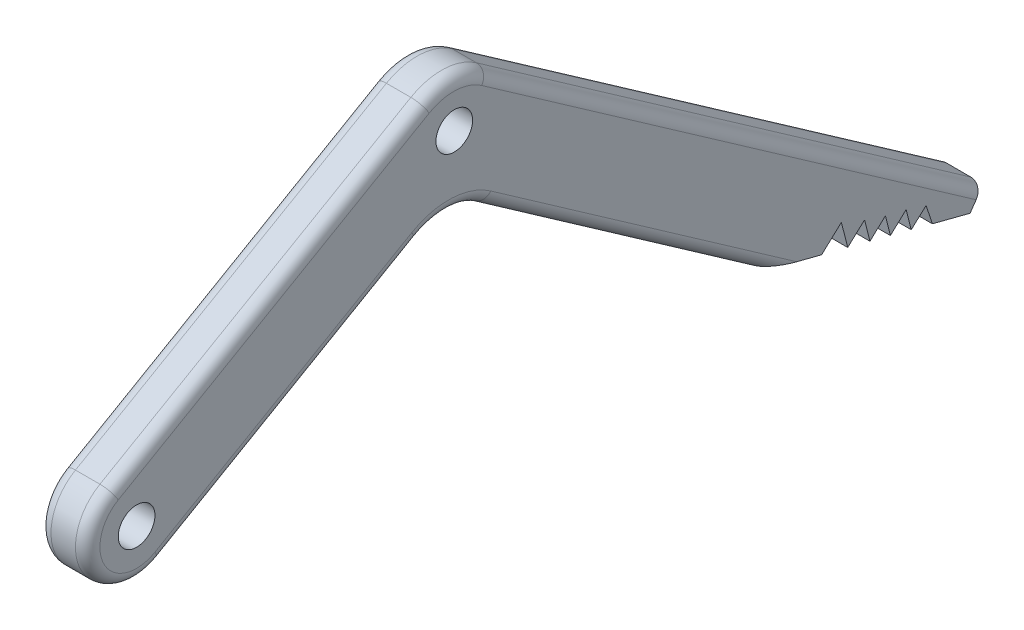
from build123d import *

# Parameters (mm, degrees)
SKETCH1_R           = 1.5
BOSS_EXTRUDE1_DEPTH = 4
FILLET1_R           = 1


with BuildPart() as part:
    # Sketch1 → Boss-Extrude1 (new body)
    with BuildSketch(Plane(origin=(0, 0, 0), x_dir=(0, 0, -1), z_dir=(1, 0, 0))):
        with BuildLine():
            Line((2, -3.464101615), (23.015290845, 8.669082211))
            ThreePointArc((23.015290845, 8.669082211), (25.733387782, 9.3341963), (28.383173027, 8.434715414))
            Line((28.383173027, 8.434715414), (51.232670073, -7.564674663))
            Line((51.232670073, -7.564674663), (56.023067, -8.799461594))
            Line((56.023067, -8.799461594), (57.638075063, -7.307602004))
            Line((57.638075063, -7.307602004), (58.156839412, -9.349469104))
            Line((58.156839412, -9.349469104), (59.53422498, -8.07711269))
            Line((59.53422498, -8.07711269), (59.976661488, -9.818551844))
            Line((59.976661488, -9.818551844), (61.239859239, -8.642065932))
            Line((61.239859239, -8.642065932), (61.648229646, -10.249420215))
            Line((61.648229646, -10.249420215), (62.934954569, -9.051022147))
            Line((62.934954569, -9.051022147), (63.350930911, -10.688313547))
            Line((63.350930911, -10.688313547), (64.567456775, -9.58151124))
            Line((64.567456775, -9.58151124), (65.081008751, -11.134263546))
            Line((65.081008751, -11.134263546), (68.163696398, -11.928866264))
            Line((68.163696398, -11.928866264), (69.232670073, -10.40221364))
            Line((69.232670073, -10.40221364), (28.796925265, 17.911199687))
            ThreePointArc((28.796925265, 17.911199687), (26.147140021, 18.810680574), (23.429043084, 18.145566485))
            Line((23.429043084, 18.145566485), (-2, 3.464101615))
            ThreePointArc((-2, 3.464101615), (-3.464101615, -2), (2, -3.464101615))
        make_face()
        Circle(SKETCH1_R, mode=Mode.SUBTRACT)
        with Locations((25.980762114, 15)):
            Circle(SKETCH1_R, mode=Mode.SUBTRACT)
    extrude(amount=BOSS_EXTRUDE1_DEPTH)

    # Fillet1
    fillet1_edges = [part.edges().sort_by_distance(p)[0] for p in [
        (4, 9.3341963, -25.733387782),
        (4, 0.435020376, -39.80792155),
        (0, 10.80483405, -10.714521542),
        (0, 18.810680574, -26.147140021),
        (0, 3.754493023, -49.014797669),
        (0, 0.435020376, -39.80792155),
        (0, 9.3341963, -25.733387782),
        (0, 2.602490298, -12.507645422),
        (0, -2, 3.464101615),
        (4, -2, 3.464101615),
        (4, 3.754493023, -49.014797669),
        (4, 18.810680574, -26.147140021),
        (4, 10.80483405, -10.714521542),
        (4, 2.602490298, -12.507645422),
    ]]
    fillet(fillet1_edges, radius=FILLET1_R)


solid = part.part
